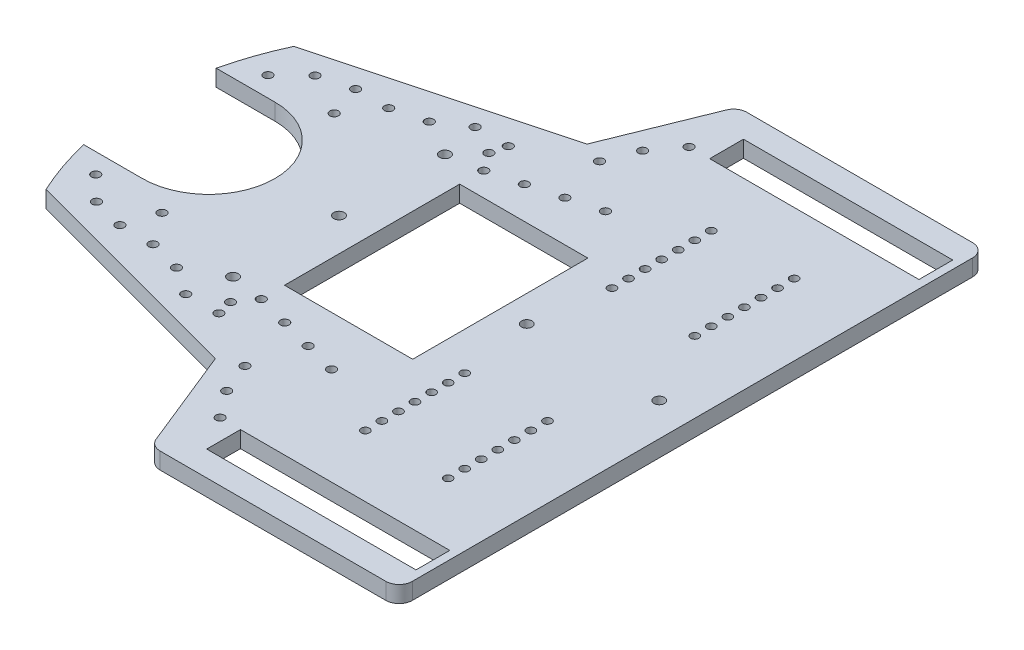
from build123d import *

# Parameters (mm, degrees)
BOSS_EXTRUDE1_DEPTH = 6.35
SKETCH2_R           = 1.5875
SKETCH2_W           = 80.264
SKETCH2_H           = 12.954
CUT_EXTRUDE1_DEPTH  = 162.484606465
SKETCH7_R           = 2.032
SKETCH7_W           = 49.149
SKETCH7_H           = 67.183
CUT_EXTRUDE4_DEPTH  = 162.484606465
SKETCH8_R           = 1.651
CUT_EXTRUDE5_DEPTH  = 162.484606465
CUT_EXTRUDE6_DEPTH  = 160.416662013
FILLET1_R           = 5.08
FILLET2_R           = 5.08
SKETCH10_R          = 1.651
CUT_EXTRUDE7_DEPTH  = 160.416662013


with BuildPart() as part:
    # Sketch1 → Boss-Extrude1 (new body)
    with BuildSketch(Plane(origin=(0, 0, 0), x_dir=(1, 0, 0), z_dir=(0, 1, 0))):
        with BuildLine():
            Line((-3.175, 112.5), (95.25, 112.5))
            Line((95.25, 112.5), (95.25, -112.5))
            Line((95.25, -112.5), (-3.175, -112.5))
            ThreePointArc((-3.175, -112.5), (-115.675, 0), (-3.175, 112.5))
        make_face()
    extrude(amount=-BOSS_EXTRUDE1_DEPTH)

    # Sketch2 → Cut-Extrude1 (cut, through all)
    with BuildSketch(Plane(origin=(0, 0, 0), x_dir=(1, 0, 0), z_dir=(0, 1, 0))):
        with Locations(Location((36.144045702, -66.3448, 0), (0, 0, 270))):
            Circle(SKETCH2_R)
        with Locations(Location((36.144045702, -59.9948, 0), (0, 0, 270))):
            Circle(SKETCH2_R)
        with Locations(Location((36.144045702, -53.6448, 0), (0, 0, 270))):
            Circle(SKETCH2_R)
        with Locations(Location((36.144045702, -47.2948, 0), (0, 0, 270))):
            Circle(SKETCH2_R)
        with Locations(Location((36.144045702, -40.9448, 0), (0, 0, 270))):
            Circle(SKETCH2_R)
        with Locations(Location((36.144045702, -34.5948, 0), (0, 0, 270))):
            Circle(SKETCH2_R)
        with Locations(Location((36.144045702, -28.2448, 0), (0, 0, 270))):
            Circle(SKETCH2_R)
        with Locations(Location((67.894045702, -66.3448, 0), (0, 0, 270))):
            Circle(SKETCH2_R)
        with Locations(Location((67.894045702, -59.9948, 0), (0, 0, 270))):
            Circle(SKETCH2_R)
        with Locations(Location((67.894045702, -53.6448, 0), (0, 0, 270))):
            Circle(SKETCH2_R)
        with Locations(Location((67.894045702, -47.2948, 0), (0, 0, 270))):
            Circle(SKETCH2_R)
        with Locations(Location((67.894045702, -40.9448, 0), (0, 0, 270))):
            Circle(SKETCH2_R)
        with Locations(Location((67.894045702, -34.5948, 0), (0, 0, 270))):
            Circle(SKETCH2_R)
        with Locations(Location((67.894045702, -28.2448, 0), (0, 0, 270))):
            Circle(SKETCH2_R)
        with Locations(Location((36.144045702, 66.3448, 0), (0, 0, 270))):
            Circle(SKETCH2_R)
        with Locations(Location((36.144045702, 59.9948, 0), (0, 0, 270))):
            Circle(SKETCH2_R)
        with Locations(Location((36.144045702, 53.6448, 0), (0, 0, 270))):
            Circle(SKETCH2_R)
        with Locations(Location((36.144045702, 47.2948, 0), (0, 0, 270))):
            Circle(SKETCH2_R)
        with Locations(Location((36.144045702, 40.9448, 0), (0, 0, 270))):
            Circle(SKETCH2_R)
        with Locations(Location((36.144045702, 34.5948, 0), (0, 0, 270))):
            Circle(SKETCH2_R)
        with Locations(Location((36.144045702, 28.2448, 0), (0, 0, 270))):
            Circle(SKETCH2_R)
        with Locations(Location((67.894045702, 66.3448, 0), (0, 0, 270))):
            Circle(SKETCH2_R)
        with Locations(Location((67.894045702, 59.9948, 0), (0, 0, 270))):
            Circle(SKETCH2_R)
        with Locations(Location((67.894045702, 53.6448, 0), (0, 0, 270))):
            Circle(SKETCH2_R)
        with Locations(Location((67.894045702, 47.2948, 0), (0, 0, 270))):
            Circle(SKETCH2_R)
        with Locations(Location((67.894045702, 40.9448, 0), (0, 0, 270))):
            Circle(SKETCH2_R)
        with Locations(Location((67.894045702, 34.5948, 0), (0, 0, 270))):
            Circle(SKETCH2_R)
        with Locations(Location((67.894045702, 28.2448, 0), (0, 0, 270))):
            Circle(SKETCH2_R)
        with Locations((52.019045702, -96.4438)):
            Rectangle(SKETCH2_W, SKETCH2_H)
        with Locations((52.019045702, 96.4438)):
            Rectangle(SKETCH2_W, SKETCH2_H)
    extrude(amount=-CUT_EXTRUDE1_DEPTH, mode=Mode.SUBTRACT)

    # Sketch7 → Cut-Extrude4 (cut, through all)
    with BuildSketch(Plane(origin=(0, 0, 0), x_dir=(1, 0, 0), z_dir=(0, 1, 0))):
        with Locations(Location((-40.297137944, 0, 0), (0, 0, 270))):
            Circle(SKETCH7_R)
        with Locations(Location((31.711862056, 0, 0), (0, 0, 270))):
            Circle(SKETCH7_R)
        with Locations(Location((82.511862056, 0, 0), (0, 0, 270))):
            Circle(SKETCH7_R)
        with Locations(Location((-40.297137944, 40.64, 0), (0, 0, 270))):
            Circle(SKETCH7_R)
        with Locations(Location((-40.297137944, -40.64, 0), (0, 0, 270))):
            Circle(SKETCH7_R)
        with Locations((-3.022637944, 0)):
            Rectangle(SKETCH7_W, SKETCH7_H)
    extrude(amount=-CUT_EXTRUDE4_DEPTH, mode=Mode.SUBTRACT)

    # Sketch8 → Cut-Extrude5 (cut, through all)
    with BuildSketch(Plane(origin=(0, 0, 0), x_dir=(1, 0, 0), z_dir=(0, 1, 0))):
        with Locations(Location((-100.5586, 33.02, 0), (0, 0, 270))):
            Circle(SKETCH8_R)
        with Locations(Location((-100.5586, -33.02, 0), (0, 0, 270))):
            Circle(SKETCH8_R)
        with Locations(Location((-75.1586, 33.02, 0), (0, 0, 270))):
            Circle(SKETCH8_R)
        with Locations(Location((-75.1586, -33.02, 0), (0, 0, 270))):
            Circle(SKETCH8_R)
        with BuildLine():
            Line((-90.2716, 25.4), (-229.776686608, 25.4))
            Line((-229.776686608, 25.4), (-229.776686608, -25.4))
            Line((-229.776686608, -25.4), (-90.2716, -25.4))
            ThreePointArc((-90.2716, -25.4), (-64.8716, 0), (-90.2716, 25.4))
        make_face()
    extrude(amount=-CUT_EXTRUDE5_DEPTH, mode=Mode.SUBTRACT)

    # Sketch9 → Cut-Extrude6 (cut, through all)
    with BuildSketch(Plane(origin=(0, 0, 0), x_dir=(1, 0, 0), z_dir=(0, 1, 0))):
        Polygon((-105.15131959, 47.508738596), (-16.481779133, 71.267670354), (15.119014667, 149.482379647), (-15.990379699, 149.482379647), (-132.083987526, 149.482379647), (-132.083987526, 47.508738596), align=None)
        Polygon((-105.15131959, -47.508738596), (-16.481779133, -71.267670354), (15.119014667, -149.482379647), (-132.083987526, -149.482379647), (-132.083987526, -47.508738596), align=None)
    extrude(amount=-CUT_EXTRUDE6_DEPTH, mode=Mode.SUBTRACT)

    # Fillet1
    fillet1_edges = [part.edges().sort_by_distance(p)[0] for p in [
        (0.177163396, -3.175, -112.5),
    ]]
    fillet(fillet1_edges, radius=FILLET1_R)

    # Fillet2
    fillet2_edges = [part.edges().sort_by_distance(p)[0] for p in [
        (0.177163396, -3.175, 112.5),
        (95.25, -3.175, -112.5),
        (95.25, -3.175, 112.5),
    ]]
    fillet(fillet2_edges, radius=FILLET2_R)

    # Sketch10 → Cut-Extrude7 (cut, through all)
    with BuildSketch(Plane(origin=(0, 0, 0), x_dir=(1, 0, 0), z_dir=(0, 1, 0))):
        with Locations(Location((-91.401386068, 41.91, 0), (0, 0, 270))):
            Circle(SKETCH10_R)
        with Locations(Location((-79.134128074, 45.197001873, 0), (0, 0, 270))):
            Circle(SKETCH10_R)
        with Locations(Location((-66.434128074, 45.197001873, 0), (0, 0, 270))):
            Circle(SKETCH10_R)
        with Locations(Location((-54.16687008, 48.484003746, 0), (0, 0, 270))):
            Circle(SKETCH10_R)
        with Locations(Location((-43.57652014, 55.493603459, 0), (0, 0, 270))):
            Circle(SKETCH10_R)
        with Locations(Location((-30.87652014, 55.493603459, 0), (0, 0, 270))):
            Circle(SKETCH10_R)
        with Locations(Location((-32.363085711, 49.531314612, 0), (0, 0, 270))):
            Circle(SKETCH10_R)
        with Locations(Location((-27.437235207, 42.658017348, 0), (0, 0, 270))):
            Circle(SKETCH10_R)
        with Locations(Location((-15.169977213, 45.94501922, 0), (0, 0, 270))):
            Circle(SKETCH10_R)
        with Locations(Location((-2.902719219, 49.232021093, 0), (0, 0, 270))):
            Circle(SKETCH10_R)
        with Locations(Location((9.364538775, 52.519022966, 0), (0, 0, 270))):
            Circle(SKETCH10_R)
        with Locations(Location((-8.367598507, 67.98932858, 0), (0, 0, 270))):
            Circle(SKETCH10_R)
        with Locations(Location((-3.61009477, 79.764563533, 0), (0, 0, 270))):
            Circle(SKETCH10_R)
        with Locations(Location((4.032956024, 89.907234511, 0), (0, 0, 270))):
            Circle(SKETCH10_R)
        with Locations(Location((-91.401386068, -41.91, 0), (0, 0, 270))):
            Circle(SKETCH10_R)
        with Locations(Location((-79.134128074, -45.197001873, 0), (0, 0, 270))):
            Circle(SKETCH10_R)
        with Locations(Location((-66.434128074, -45.197001873, 0), (0, 0, 270))):
            Circle(SKETCH10_R)
        with Locations(Location((-54.16687008, -48.484003746, 0), (0, 0, 270))):
            Circle(SKETCH10_R)
        with Locations(Location((-43.57652014, -55.493603459, 0), (0, 0, 270))):
            Circle(SKETCH10_R)
        with Locations(Location((-30.87652014, -55.493603459, 0), (0, 0, 270))):
            Circle(SKETCH10_R)
        with Locations(Location((-32.363085711, -49.531314612, 0), (0, 0, 270))):
            Circle(SKETCH10_R)
        with Locations(Location((-27.438316181, -42.662051597, 0), (0, 0, 270))):
            Circle(SKETCH10_R)
        with Locations(Location((-15.171058187, -45.94905347, 0), (0, 0, 270))):
            Circle(SKETCH10_R)
        with Locations(Location((-2.903800193, -49.236055343, 0), (0, 0, 270))):
            Circle(SKETCH10_R)
        with Locations(Location((9.363457801, -52.523057216, 0), (0, 0, 270))):
            Circle(SKETCH10_R)
        with Locations(Location((-8.367598507, -67.98932858, 0), (0, 0, 270))):
            Circle(SKETCH10_R)
        with Locations(Location((-3.61009477, -79.764563533, 0), (0, 0, 270))):
            Circle(SKETCH10_R)
        with Locations(Location((4.032956024, -89.907234511, 0), (0, 0, 270))):
            Circle(SKETCH10_R)
    extrude(amount=-CUT_EXTRUDE7_DEPTH, mode=Mode.SUBTRACT)


solid = part.part
